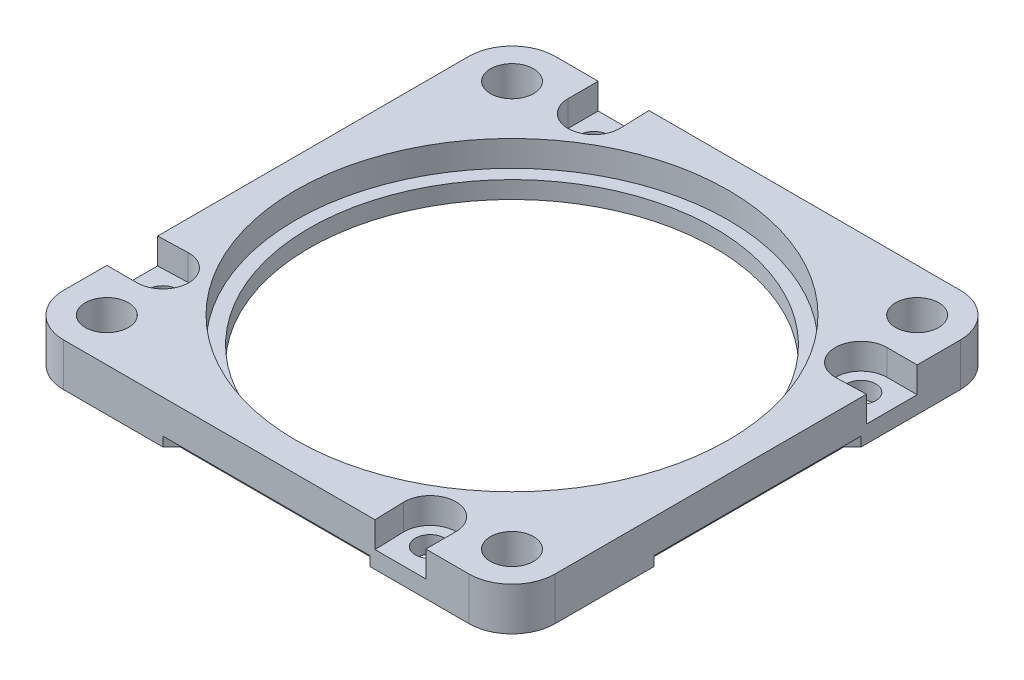
from build123d import *

# Parameters (mm, degrees)
SKETCH1_W           = 57
SKETCH1_H           = 57
SKETCH1_R           = 25.1
BOSS_EXTRUDE1_DEPTH = 5
SKETCH1_3_R         = 25.1
SKETCH1_3_R_2       = 23.5
BOSS_EXTRUDE2_DEPTH = 2
FILLET1_R           = 5
SKETCH2_R           = 2.5
SKETCH2_R_2         = 1.7
CUT_EXTRUDE2_DEPTH  = 41.614036982
SKETCH3_R           = 1.7
CUT_EXTRUDE3_DEPTH  = 3
CUT_EXTRUDE4_DEPTH  = 1.1
CIRPATTERN1_COUNT   = 4


with BuildPart() as part:
    # Sketch1 → Boss-Extrude1 (new body)
    with BuildSketch(Plane(origin=(0, 0, 0), x_dir=(1, 0, 0), z_dir=(0, 1, 0))):
        Rectangle(SKETCH1_W, SKETCH1_H)
        Circle(SKETCH1_R, mode=Mode.SUBTRACT)
    extrude(amount=BOSS_EXTRUDE1_DEPTH)

    # Sketch1<3> → Boss-Extrude2 (add)
    with BuildSketch(Plane(origin=(0, 0, 0), x_dir=(1, 0, 0), z_dir=(0, 1, 0))):
        Circle(SKETCH1_3_R)
        Circle(SKETCH1_3_R_2, mode=Mode.SUBTRACT)
    extrude(amount=BOSS_EXTRUDE2_DEPTH)

    # Fillet1
    fillet1_edges = [part.edges().sort_by_distance(p)[0] for p in [
        (-28.5, 2.5, -28.5),
        (28.5, 2.5, -28.5),
        (-28.5, 2.5, 28.5),
        (28.5, 2.5, 28.5),
    ]]
    fillet(fillet1_edges, radius=FILLET1_R)

    # Sketch2 → Cut-Extrude2 (cut, through all)
    with BuildSketch(Plane(origin=(0, 5, 0), x_dir=(1, 0, 0), z_dir=(0, 1, 0))):
        with Locations((-23.5, 23.5)):
            Circle(SKETCH2_R)
        with Locations((-15.5, 25)):
            Circle(SKETCH2_R_2)
    cut_extrude2 = extrude(amount=-CUT_EXTRUDE2_DEPTH, mode=Mode.SUBTRACT)

    # Sketch3 → Cut-Extrude3 (cut)
    with BuildSketch(Plane(origin=(0, 5, 0), x_dir=(1, 0, 0), z_dir=(0, 1, 0))):
        with BuildLine():
            ThreePointArc((-18.5, 25), (-15.451669698, 22.000389328), (-12.501557212, 25.09664806))
            Line((-12.501557212, 25.09664806), (-12.611256608, 28.5))
            Line((-12.611256608, 28.5), (-18.5, 28.5))
            Line((-18.5, 28.5), (-18.5, 25))
        make_face()
        with Locations((-15.5, 25)):
            Circle(SKETCH3_R, mode=Mode.SUBTRACT)
    cut_extrude3 = extrude(amount=-CUT_EXTRUDE3_DEPTH, mode=Mode.SUBTRACT)

    # Sketch4 → Cut-Extrude4 (cut)
    with BuildSketch(Plane.XZ):
        Polygon((-27.5, -11), (-27.5, 11), (-28.5, 12), (-28.5, -12), align=None)
    cut_extrude4 = extrude(amount=-CUT_EXTRUDE4_DEPTH, mode=Mode.SUBTRACT)

    # CirPattern1: Cut-Extrude2, Cut-Extrude3, Cut-Extrude4 ×4 about axis
    cirpattern1_axis = Axis((0, 2, 0), (0, 1, 0))
    add([cut_extrude2.rotate(cirpattern1_axis, i * 360 / CIRPATTERN1_COUNT) for i in range(1, CIRPATTERN1_COUNT)], mode=Mode.SUBTRACT)
    add([cut_extrude3.rotate(cirpattern1_axis, i * 360 / CIRPATTERN1_COUNT) for i in range(1, CIRPATTERN1_COUNT)], mode=Mode.SUBTRACT)
    add([cut_extrude4.rotate(cirpattern1_axis, i * 360 / CIRPATTERN1_COUNT) for i in range(1, CIRPATTERN1_COUNT)], mode=Mode.SUBTRACT)


solid = part.part
